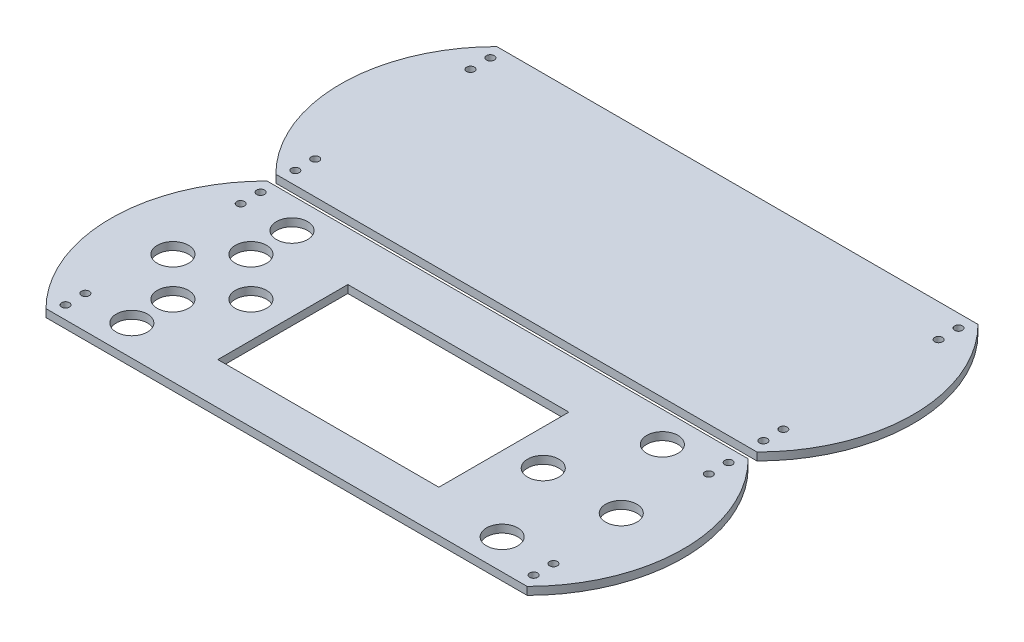
from build123d import *

# Parameters (mm, degrees)
SKETCH2_R             = 6
SKETCH2_R_2           = 1.5
SKETCH2_W             = 85
SKETCH2_H             = 50
BOSS_EXTRUDE1_DEPTH   = 3
BOSS_EXTRUDE1_2_DEPTH = 3


with BuildPart() as part:
    # Sketch2 → Boss-Extrude1 (new body)
    with BuildSketch(Plane(origin=(0, 0, 0), x_dir=(1, 0, 0), z_dir=(0, 1, 0))):
        with BuildLine():
            Line((6.665393172, 28.595491829), (191.665393172, 28.595491829))
            ThreePointArc((191.665393172, 28.595491829), (209.269469573, -13.904508171), (191.665393172, -56.404508171))
            Line((191.665393172, -56.404508171), (6.665393172, -56.404508171))
            ThreePointArc((6.665393172, -56.404508171), (-10.938683229, -13.904508171), (6.665393172, 28.595491829))
        make_face()
        with Locations(Location((42.965393172, -13.904508171, 0), (0, 0, 270))):
            Circle(SKETCH2_R, mode=Mode.SUBTRACT)
        with Locations(Location((12.965393172, -13.904508171, 0), (0, 0, 270))):
            Circle(SKETCH2_R, mode=Mode.SUBTRACT)
        with Locations(Location((27.965393172, 1.095491829, 0), (0, 0, 270))):
            Circle(SKETCH2_R, mode=Mode.SUBTRACT)
        with Locations(Location((27.965393172, -28.904508171, 0), (0, 0, 90))):
            Circle(SKETCH2_R, mode=Mode.SUBTRACT)
        with Locations(Location((155.365393172, -13.904508171, 0), (0, 0, 90))):
            Circle(SKETCH2_R, mode=Mode.SUBTRACT)
        with Locations(Location((185.365393172, -13.904508171, 0), (0, 0, 90))):
            Circle(SKETCH2_R, mode=Mode.SUBTRACT)
        with Locations(Location((27.965393172, 16.895491829, 0), (0, 0, 270))):
            Circle(SKETCH2_R, mode=Mode.SUBTRACT)
        with Locations(Location((27.965393172, -44.704508171, 0), (0, 0, 90))):
            Circle(SKETCH2_R, mode=Mode.SUBTRACT)
        with Locations(Location((170.365393172, -44.704508171, 0), (0, 0, 270))):
            Circle(SKETCH2_R, mode=Mode.SUBTRACT)
        with Locations(Location((170.365393172, 16.895491829, 0), (0, 0, 90))):
            Circle(SKETCH2_R, mode=Mode.SUBTRACT)
        with Locations(Location((9.165393172, 23.595491829, 0), (0, 0, 270))):
            Circle(SKETCH2_R_2, mode=Mode.SUBTRACT)
        with Locations(Location((189.165393172, 23.595491829, 0), (0, 0, 90))):
            Circle(SKETCH2_R_2, mode=Mode.SUBTRACT)
        with Locations(Location((189.165393172, -51.404508171, 0), (0, 0, 270))):
            Circle(SKETCH2_R_2, mode=Mode.SUBTRACT)
        with Locations(Location((9.165393172, -51.404508171, 0), (0, 0, 90))):
            Circle(SKETCH2_R_2, mode=Mode.SUBTRACT)
        with Locations(Location((9.165393172, 15.959416538, 0), (0, 0, 270))):
            Circle(SKETCH2_R_2, mode=Mode.SUBTRACT)
        with Locations(Location((9.165393172, -43.768432879, 0), (0, 0, 90))):
            Circle(SKETCH2_R_2, mode=Mode.SUBTRACT)
        with Locations(Location((189.165393172, -43.768432879, 0), (0, 0, 270))):
            Circle(SKETCH2_R_2, mode=Mode.SUBTRACT)
        with Locations(Location((189.165393172, 15.959416538, 0), (0, 0, 90))):
            Circle(SKETCH2_R_2, mode=Mode.SUBTRACT)
        with Locations((99.165393172, -15.342407185)):
            Rectangle(SKETCH2_W, SKETCH2_H, mode=Mode.SUBTRACT)
    extrude(amount=BOSS_EXTRUDE1_DEPTH)


with BuildPart() as body_2:
    # Sketch2 → Boss-Extrude1 2 (new body)
    with BuildSketch(Plane(origin=(0, 0, 0), x_dir=(1, 0, 0), z_dir=(0, 1, 0))):
        with BuildLine():
            Line((6.096572166, 117.53887725), (191.096572166, 117.53887725))
            ThreePointArc((191.096572166, 117.53887725), (208.700648567, 75.03887725), (191.096572166, 32.53887725))
            Line((191.096572166, 32.53887725), (6.096572166, 32.53887725))
            ThreePointArc((6.096572166, 32.53887725), (-11.507504235, 75.03887725), (6.096572166, 117.53887725))
        make_face()
        with Locations(Location((8.596572166, 112.53887725, 0), (0, 0, 270))):
            Circle(SKETCH2_R_2, mode=Mode.SUBTRACT)
        with Locations(Location((188.596572166, 112.53887725, 0), (0, 0, 90))):
            Circle(SKETCH2_R_2, mode=Mode.SUBTRACT)
        with Locations(Location((188.596572166, 37.53887725, 0), (0, 0, 270))):
            Circle(SKETCH2_R_2, mode=Mode.SUBTRACT)
        with Locations(Location((8.596572166, 37.53887725, 0), (0, 0, 90))):
            Circle(SKETCH2_R_2, mode=Mode.SUBTRACT)
        with Locations(Location((8.596572166, 104.902801959, 0), (0, 0, 270))):
            Circle(SKETCH2_R_2, mode=Mode.SUBTRACT)
        with Locations(Location((8.596572166, 45.174952542, 0), (0, 0, 90))):
            Circle(SKETCH2_R_2, mode=Mode.SUBTRACT)
        with Locations(Location((188.596572166, 45.174952542, 0), (0, 0, 270))):
            Circle(SKETCH2_R_2, mode=Mode.SUBTRACT)
        with Locations(Location((188.596572166, 104.902801959, 0), (0, 0, 90))):
            Circle(SKETCH2_R_2, mode=Mode.SUBTRACT)
    extrude(amount=BOSS_EXTRUDE1_2_DEPTH)


solid = Compound([part.part, body_2.part])
